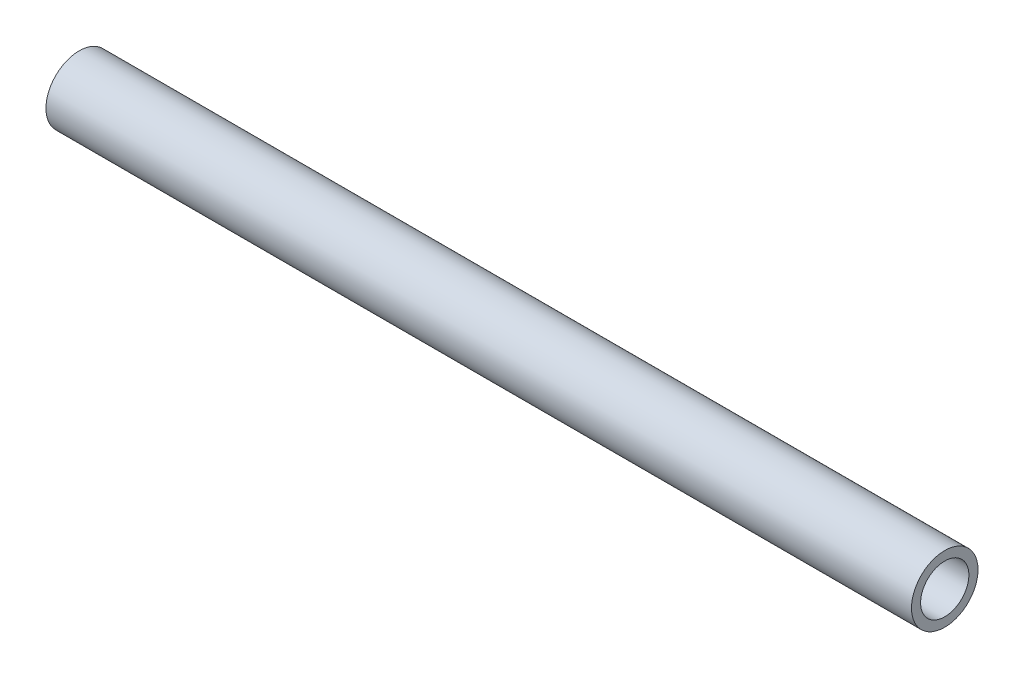
from build123d import *

# Parameters (mm, degrees)
SKETCH1_R           = 13.15
SKETCH1_R_2         = 9.55
BOSS_EXTRUDE1_DEPTH = 342.2


with BuildPart() as part:
    # Sketch1 → Boss-Extrude1 (new body)
    with BuildSketch(Plane(origin=(0, 0, 0), x_dir=(0, 0, -1), z_dir=(1, 0, 0))):
        Circle(SKETCH1_R)
        Circle(SKETCH1_R_2, mode=Mode.SUBTRACT)
    extrude(amount=BOSS_EXTRUDE1_DEPTH)


solid = part.part
